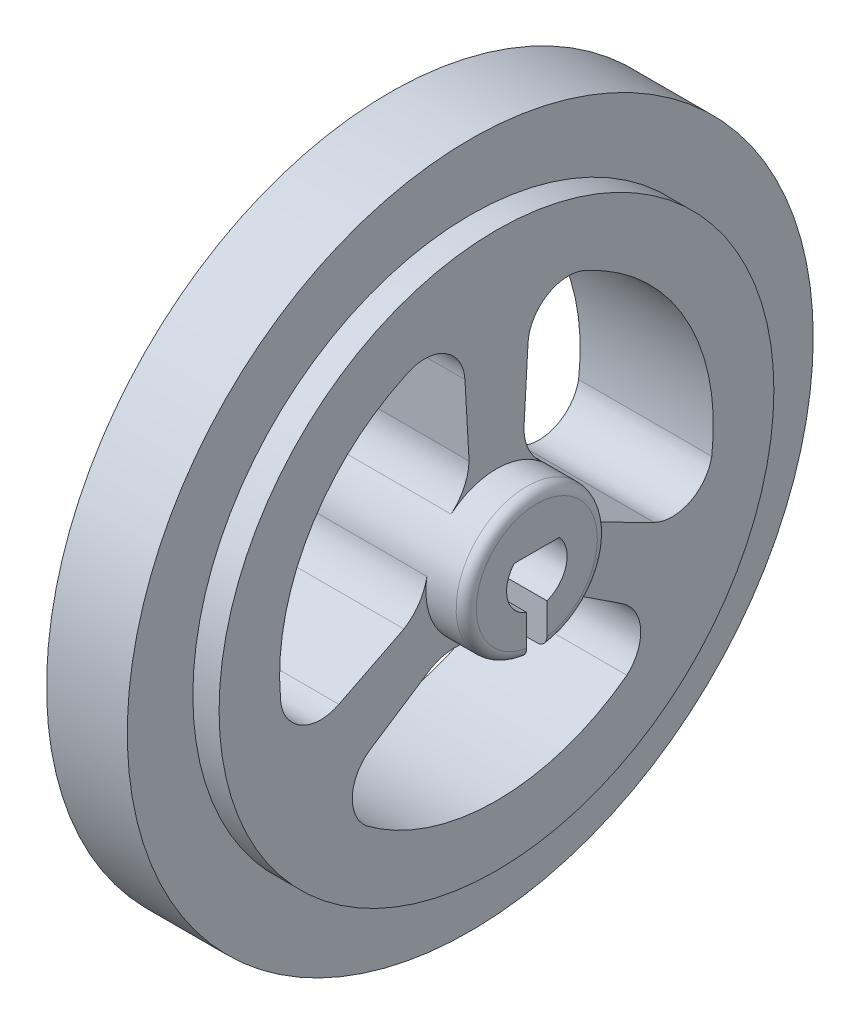
from build123d import *

# Parameters (mm, degrees)
RESSALTO_EXTRUS_O1_DEPTH      = 5.3
RESSALTO_EXTRUS_O1_DEPTH_BACK = 3.3
ESBO_O1_3_R                   = 13.75
RESSALTO_EXTRUS_O2_DEPTH      = 3.3
FILETE2_R                     = 0.5
ESBO_O2_R                     = 17
ESBO_O2_R_2                   = 13.75
RESSALTO_EXTRUS_O3_DEPTH      = 2


with BuildPart() as part:
    # Esboço1 → Ressalto-extrusão1 (new, two sides: drawn at the far end of the back side and taken through both)
    with BuildSketch(Plane(origin=(0, 0, 0), x_dir=(0, 0, -1), z_dir=(1, 0, 0)).offset(-RESSALTO_EXTRUS_O1_DEPTH_BACK)):
        with BuildLine():
            ThreePointArc((0.5, -1.414213562), (1.4531398, -0.37200097), (1.118033989, 1))
            Line((1.118033989, 1), (-1.118033989, 1))
            ThreePointArc((-1.118033989, 1), (-1.4531398, -0.37200097), (-0.5, -1.414213562))
            Line((-0.5, -1.414213562), (-0.5, -3.464101615))
            ThreePointArc((-0.5, -3.464101615), (0, 3.5), (0.5, -3.464101615))
            Line((0.5, -3.464101615), (0.5, -1.414213562))
        make_face()
    extrude(amount=RESSALTO_EXTRUS_O1_DEPTH + RESSALTO_EXTRUS_O1_DEPTH_BACK)

    # Esboço1<3> → Ressalto-extrusão2 (add, symmetric)
    with BuildSketch(Plane(origin=(0, 0, 0), x_dir=(0, 0, -1), z_dir=(1, 0, 0))):
        Circle(ESBO_O1_3_R)
        with BuildLine():
            ThreePointArc((3.446771953, 0.608081497), (3.031088913, -1.75), (1.196771953, -3.28903282))
            ThreePointArc((1.196771953, -3.28903282), (2.228560776, -3.144612223), (3.229618168, -3.433280857))
            Line((3.229618168, -3.433280857), (6.244929793, -5.410607922))
            ThreePointArc((6.244929793, -5.410607922), (7.143531761, -6.946693722), (6.462297299, -8.590763273))
            ThreePointArc((6.462297299, -8.590763273), (0, -10.75), (-6.462297299, -8.590763273))
            ThreePointArc((-6.462297299, -8.590763273), (-7.143531761, -6.946693722), (-6.244929793, -5.410607922))
            Line((-6.244929793, -5.410607922), (-3.229618168, -3.433280857))
            ThreePointArc((-3.229618168, -3.433280857), (-2.228560776, -3.144612223), (-1.196771953, -3.28903282))
            ThreePointArc((-1.196771953, -3.28903282), (-3.031088913, -1.75), (-3.446771953, 0.608081497))
            ThreePointArc((-3.446771953, 0.608081497), (-3.837594458, -0.357684134), (-4.588117525, -1.08029095))
            Line((-4.588117525, -1.08029095), (-7.808188807, -2.702963885))
            ThreePointArc((-7.808188807, -2.702963885), (-9.742921821, -2.628468224), (-10.707946608, -0.949936544))
            ThreePointArc((-10.707946608, -0.949936544), (-9.309773091, 5.375), (-4.531304125, 9.748322057))
            ThreePointArc((-4.531304125, 9.748322057), (-2.595140656, 9.751851916), (-1.563259014, 8.113571807))
            Line((-1.563259014, 8.113571807), (-1.358499357, 4.513571807))
            ThreePointArc((-1.358499357, 4.513571807), (-1.609033682, 3.502296357), (-2.25, 2.680951324))
            ThreePointArc((-2.25, 2.680951324), (0, 3.5), (2.25, 2.680951324))
            ThreePointArc((2.25, 2.680951324), (1.609033682, 3.502296357), (1.358499357, 4.513571807))
            Line((1.358499357, 4.513571807), (1.563259014, 8.113571807))
            ThreePointArc((1.563259014, 8.113571807), (2.595140656, 9.751851916), (4.531304125, 9.748322057))
            ThreePointArc((4.531304125, 9.748322057), (9.396801436, 5.221362156), (10.670967882, -1.301131991))
            ThreePointArc((10.670967882, -1.301131991), (9.587779116, -2.713133117), (7.808188807, -2.702963885))
            Line((7.808188807, -2.702963885), (4.588117525, -1.08029095))
            ThreePointArc((4.588117525, -1.08029095), (3.837594458, -0.357684134), (3.446771953, 0.608081497))
        make_face(mode=Mode.SUBTRACT)
    extrude(amount=RESSALTO_EXTRUS_O2_DEPTH, both=True)

    # Filete2
    filete2_edges = [part.edges().sort_by_distance(p)[0] for p in [
        (5.3, 3.5, 0),
    ]]
    fillet(filete2_edges, radius=FILETE2_R)

    # Esboço2 → Ressalto-extrusão3 (add, symmetric)
    with BuildSketch(Plane(origin=(0, 0, 0), x_dir=(0, 0, -1), z_dir=(1, 0, 0))):
        Circle(ESBO_O2_R)
        Circle(ESBO_O2_R_2, mode=Mode.SUBTRACT)
    extrude(amount=RESSALTO_EXTRUS_O3_DEPTH, both=True)


solid = part.part
